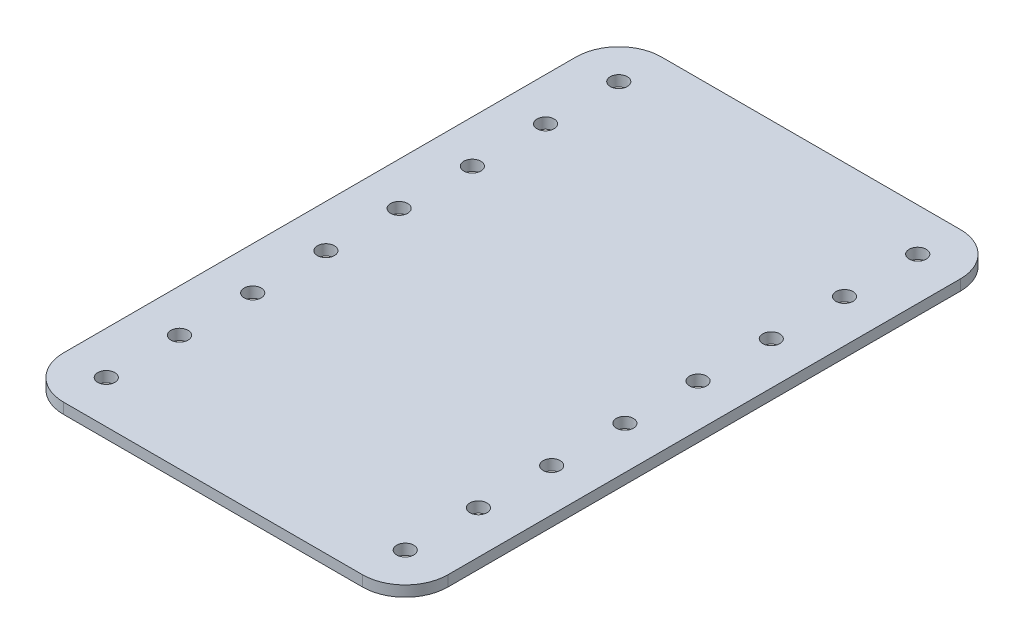
from build123d import *

# Parameters (mm, degrees)
SKETCH1_W           = 114.3
SKETCH1_H           = 177.8
BOSS_EXTRUDE1_DEPTH = 3.175
SKETCH2_R           = 2.54
CUT_EXTRUDE1_DEPTH  = 3.175
FILLET1_R           = 12.7


with BuildPart() as part:
    # Sketch1 → Boss-Extrude1 (new body)
    with BuildSketch(Plane(origin=(0, 0, 0), x_dir=(1, 0, 0), z_dir=(0, 1, 0))):
        Rectangle(SKETCH1_W, SKETCH1_H)
    extrude(amount=BOSS_EXTRUDE1_DEPTH)

    # Sketch2 → Cut-Extrude1 (cut)
    with BuildSketch(Plane(origin=(0, 3.175, 0), x_dir=(1, 0, 0), z_dir=(0, 1, 0))):
        with Locations(Location((-44.45, 76.2, 0), (0, 0, 270))):
            Circle(SKETCH2_R)
        with Locations(Location((-44.45, 54.428571429, 0), (0, 0, 270))):
            Circle(SKETCH2_R)
        with Locations(Location((-44.45, 32.657142857, 0), (0, 0, 270))):
            Circle(SKETCH2_R)
        with Locations(Location((-44.45, 10.885714286, 0), (0, 0, 270))):
            Circle(SKETCH2_R)
        with Locations(Location((-44.45, -10.885714286, 0), (0, 0, 270))):
            Circle(SKETCH2_R)
        with Locations(Location((-44.45, -32.657142857, 0), (0, 0, 270))):
            Circle(SKETCH2_R)
        with Locations(Location((-44.45, -54.428571429, 0), (0, 0, 270))):
            Circle(SKETCH2_R)
        with Locations(Location((-44.45, -76.2, 0), (0, 0, 270))):
            Circle(SKETCH2_R)
        with Locations(Location((44.45, -76.2, 0), (0, 0, 90))):
            Circle(SKETCH2_R)
        with Locations(Location((44.45, -54.428571429, 0), (0, 0, 90))):
            Circle(SKETCH2_R)
        with Locations(Location((44.45, -32.657142857, 0), (0, 0, 90))):
            Circle(SKETCH2_R)
        with Locations(Location((44.45, -10.885714286, 0), (0, 0, 90))):
            Circle(SKETCH2_R)
        with Locations(Location((44.45, 10.885714286, 0), (0, 0, 90))):
            Circle(SKETCH2_R)
        with Locations(Location((44.45, 32.657142857, 0), (0, 0, 90))):
            Circle(SKETCH2_R)
        with Locations(Location((44.45, 54.428571429, 0), (0, 0, 90))):
            Circle(SKETCH2_R)
        with Locations(Location((44.45, 76.2, 0), (0, 0, 90))):
            Circle(SKETCH2_R)
    extrude(amount=-CUT_EXTRUDE1_DEPTH, mode=Mode.SUBTRACT)

    # Fillet1
    fillet1_edges = [part.edges().sort_by_distance(p)[0] for p in [
        (57.15, 1.5875, 88.9),
        (-57.15, 1.5875, 88.9),
        (-57.15, 1.5875, -88.9),
        (57.15, 1.5875, -88.9),
    ]]
    fillet(fillet1_edges, radius=FILLET1_R)


solid = part.part
